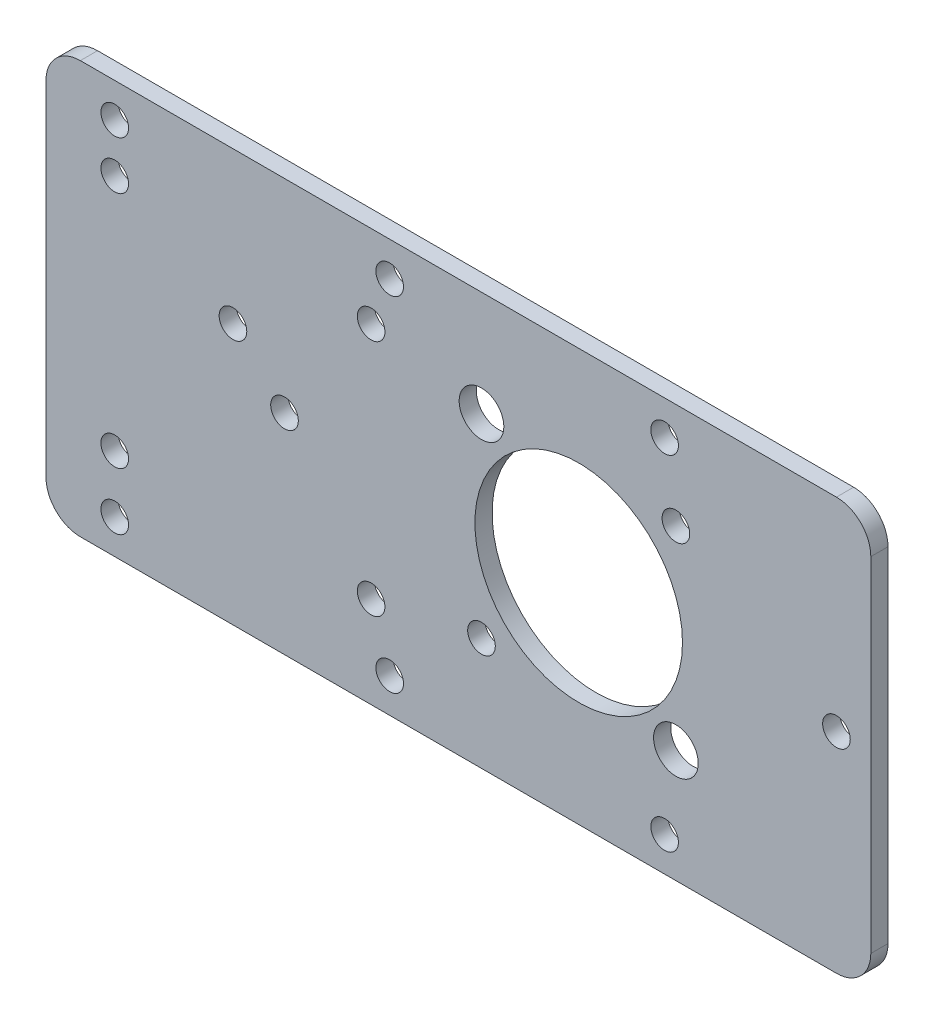
from build123d import *

# Parameters (mm, degrees)
SKETCH1_R           = 2.5527
SKETCH1_R_2         = 4.1275
SKETCH1_R_3         = 19.177
BOSS_EXTRUDE1_DEPTH = 3.175


with BuildPart() as part:
    # Sketch1 → Boss-Extrude1 (new body)
    with BuildSketch(Plane.XY):
        with BuildLine():
            Line((-24.769458796, 9.859734844), (-24.769458796, 73.359734844))
            ThreePointArc((-24.769458796, 73.359734844), (-22.909586857, 77.849862904), (-18.419458796, 79.709734844))
            Line((-18.419458796, 79.709734844), (121.280541204, 79.709734844))
            ThreePointArc((121.280541204, 79.709734844), (125.770669264, 77.849862904), (127.630541204, 73.359734844))
            Line((127.630541204, 73.359734844), (127.630541204, 9.859734844))
            ThreePointArc((127.630541204, 9.859734844), (125.770669264, 5.369606783), (121.280541204, 3.509734844))
            Line((121.280541204, 3.509734844), (-18.419458796, 3.509734844))
            ThreePointArc((-18.419458796, 3.509734844), (-22.909586857, 5.369606783), (-24.769458796, 9.859734844))
        make_face()
        with Locations((89.530541204, 9.859734844)):
            Circle(SKETCH1_R, mode=Mode.SUBTRACT)
        with Locations((89.530541204, 73.359734844)):
            Circle(SKETCH1_R, mode=Mode.SUBTRACT)
        with Locations((-12.069458796, 73.359734844)):
            Circle(SKETCH1_R, mode=Mode.SUBTRACT)
        with Locations((-12.069458796, 64.427395008)):
            Circle(SKETCH1_R, mode=Mode.SUBTRACT)
        with Locations((38.730541204, 73.359734844)):
            Circle(SKETCH1_R, mode=Mode.SUBTRACT)
        with Locations((35.301541204, 64.427395008)):
            Circle(SKETCH1_R, mode=Mode.SUBTRACT)
        with Locations((9.774192889, 51.727395008)):
            Circle(SKETCH1_R, mode=Mode.SUBTRACT)
        with Locations((19.299192889, 42.202395008)):
            Circle(SKETCH1_R, mode=Mode.SUBTRACT)
        with Locations((-12.069458796, 20.433674276)):
            Circle(SKETCH1_R, mode=Mode.SUBTRACT)
        with Locations((35.301541204, 20.433674276)):
            Circle(SKETCH1_R, mode=Mode.SUBTRACT)
        with Locations((38.730541204, 9.859734844)):
            Circle(SKETCH1_R, mode=Mode.SUBTRACT)
        with Locations((55.695028962, 24.33315969)):
            Circle(SKETCH1_R, mode=Mode.SUBTRACT)
        with Locations((55.695028962, 60.254184174)):
            Circle(SKETCH1_R_2, mode=Mode.SUBTRACT)
        with Locations((91.616053446, 60.254184174)):
            Circle(SKETCH1_R, mode=Mode.SUBTRACT)
        with Locations((91.616053446, 24.33315969)):
            Circle(SKETCH1_R_2, mode=Mode.SUBTRACT)
        with Locations((73.655541204, 42.202395008)):
            Circle(SKETCH1_R_3, mode=Mode.SUBTRACT)
        with Locations((-12.069458796, 9.859734844)):
            Circle(SKETCH1_R, mode=Mode.SUBTRACT)
        with Locations((121.280541204, 42.202395008)):
            Circle(SKETCH1_R, mode=Mode.SUBTRACT)
    extrude(amount=BOSS_EXTRUDE1_DEPTH)


solid = part.part
